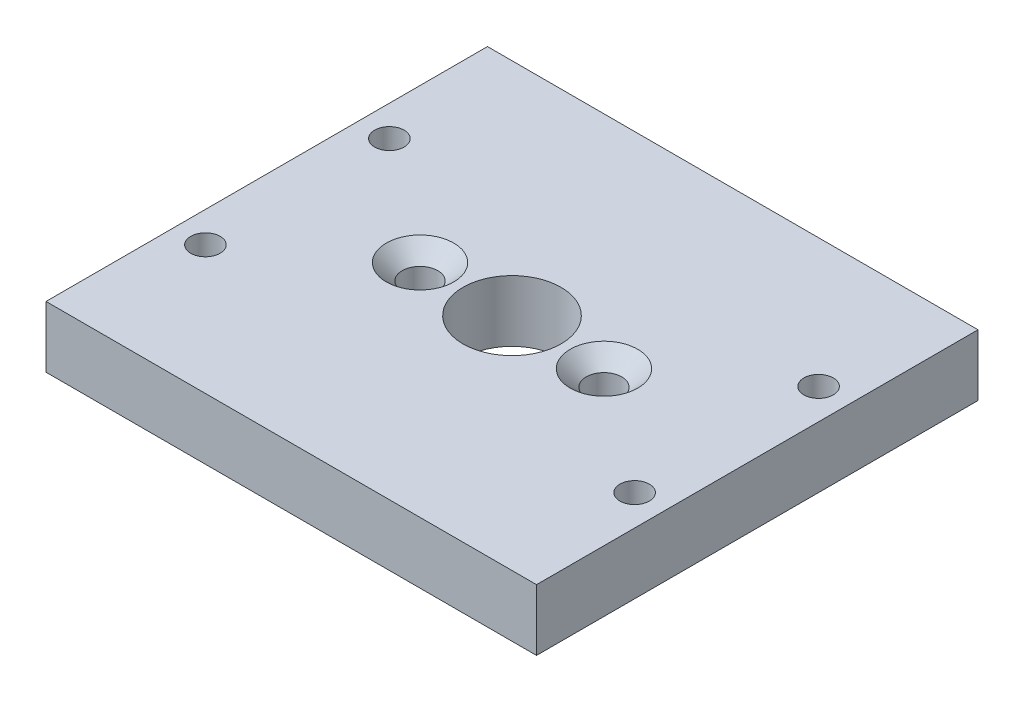
from build123d import *

# Parameters (mm, degrees)
SKETCH1_W                                            = 40
SKETCH1_H                                            = 36
BOSS_EXTRUDE1_DEPTH                                  = 5
SKETCH2_R                                            = 4
CUT_EXTRUDE1_DEPTH                                   = 28.367864367
CSK_FOR_M2_5_COUNTERSUNK_FLAT_HEAD_SCREW_D           = 2.9
CSK_FOR_M2_5_COUNTERSUNK_FLAT_HEAD_SCREW_CSINK_D     = 5.5
CSK_FOR_M2_5_COUNTERSUNK_FLAT_HEAD_SCREW_CSINK_ANGLE = 90
CSK_FOR_M2_COUNTERSUNK_FLAT_HEAD_SCREW1_D            = 2.4
CSK_FOR_M2_COUNTERSUNK_FLAT_HEAD_SCREW1_CSINK_D      = 4.4
CSK_FOR_M2_COUNTERSUNK_FLAT_HEAD_SCREW1_CSINK_ANGLE  = 90


with BuildPart() as part:
    # Sketch1 → Boss-Extrude1 (new body)
    with BuildSketch(Plane(origin=(0, 0, 0), x_dir=(1, 0, 0), z_dir=(0, 1, 0))):
        Rectangle(SKETCH1_W, SKETCH1_H)
    extrude(amount=BOSS_EXTRUDE1_DEPTH)

    # Sketch2 → Cut-Extrude1 (cut, through all)
    with BuildSketch(Plane(origin=(0, 5, 0), x_dir=(1, 0, 0), z_dir=(0, 1, 0))):
        with Locations(Location((0, 0, 0), (0, 0, 270))):
            Circle(SKETCH2_R)
    extrude(amount=-CUT_EXTRUDE1_DEPTH, mode=Mode.SUBTRACT)

    # CSK for M2.5 Countersunk Flat Head Screw1 (through all)
    with Locations(Plane(origin=(0, 5, 0), x_dir=(1, 0, 0), z_dir=(0, 1, 0))):
        with Locations((-7.5, 0), (7.5, 0)):
            CounterSinkHole(CSK_FOR_M2_5_COUNTERSUNK_FLAT_HEAD_SCREW_D / 2, CSK_FOR_M2_5_COUNTERSUNK_FLAT_HEAD_SCREW_CSINK_D / 2, counter_sink_angle=CSK_FOR_M2_5_COUNTERSUNK_FLAT_HEAD_SCREW_CSINK_ANGLE)

    # CSK for M2 Countersunk Flat Head Screw1 (through all)
    with Locations(Plane(origin=(0, 0, 0), x_dir=(-1, 0, 0), z_dir=(0, -1, 0))):
        with Locations((17.5, -7.5), (17.5, 7.5), (-17.5, 7.5), (-17.5, -7.5)):
            CounterSinkHole(CSK_FOR_M2_COUNTERSUNK_FLAT_HEAD_SCREW1_D / 2, CSK_FOR_M2_COUNTERSUNK_FLAT_HEAD_SCREW1_CSINK_D / 2, counter_sink_angle=CSK_FOR_M2_COUNTERSUNK_FLAT_HEAD_SCREW1_CSINK_ANGLE)


solid = part.part
